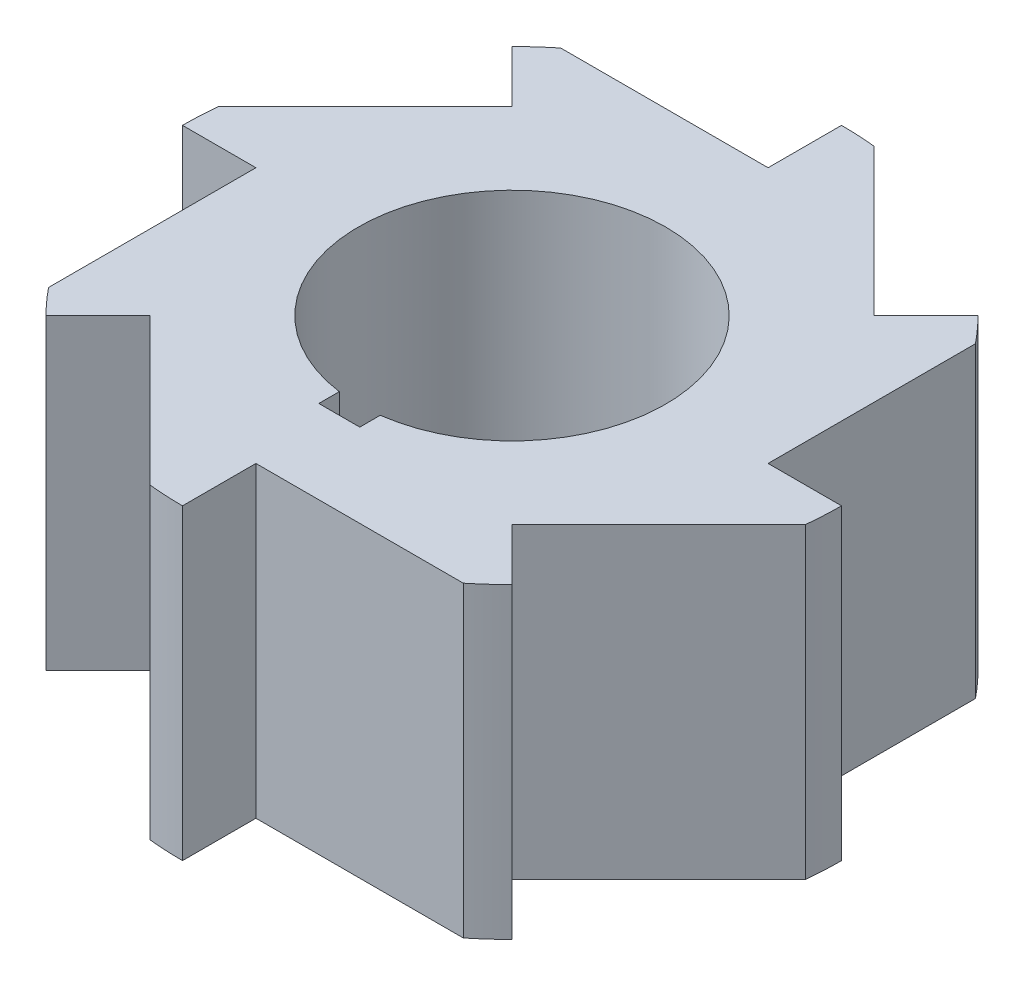
from build123d import *

# Parameters (mm, degrees)
BOSS_EXTRUDE3_DEPTH = 30


with BuildPart() as part:
    # Sketch1 → Boss-Extrude3 (new body)
    with BuildSketch(Plane(origin=(0, 0, 0), x_dir=(1, 0, 0), z_dir=(0, 1, 0))):
        with BuildLine():
            Line((0, -25), (0, -32.168320657))
            ThreePointArc((0, -32.168320657), (-1.683972021, -32.124213487), (-3.36332613, -31.992012929))
            Line((-3.36332613, -31.992012929), (-17.67766953, -17.67766953))
            Line((-17.67766953, -17.67766953), (-22.746437676, -22.746437676))
            ThreePointArc((-22.746437676, -22.746437676), (-23.905997232, -21.524501161), (-25, -20.243538572))
            Line((-25, -20.243538572), (-25, 0))
            Line((-25, 0), (-32.168320657, 0))
            ThreePointArc((-32.168320657, 0), (-32.124213487, 1.683972021), (-31.992012929, 3.36332613))
            Line((-31.992012929, 3.36332613), (-17.67766953, 17.67766953))
            Line((-17.67766953, 17.67766953), (-22.746437676, 22.746437676))
            ThreePointArc((-22.746437676, 22.746437676), (-21.524501161, 23.905997232), (-20.243538572, 25))
            Line((-20.243538572, 25), (0, 25))
            Line((0, 25), (0, 32.168320657))
            ThreePointArc((0, 32.168320657), (1.683972021, 32.124213487), (3.36332613, 31.992012929))
            Line((3.36332613, 31.992012929), (17.67766953, 17.67766953))
            Line((17.67766953, 17.67766953), (22.746437676, 22.746437676))
            ThreePointArc((22.746437676, 22.746437676), (23.905997232, 21.524501161), (25, 20.243538572))
            Line((25, 20.243538572), (25, 0))
            Line((25, 0), (32.168320657, 0))
            ThreePointArc((32.168320657, 0), (32.124213487, -1.683972021), (31.992012929, -3.36332613))
            Line((31.992012929, -3.36332613), (17.67766953, -17.67766953))
            Line((17.67766953, -17.67766953), (22.746437676, -22.746437676))
            ThreePointArc((22.746437676, -22.746437676), (21.524501161, -23.905997232), (20.243538572, -25))
            Line((20.243538572, -25), (0, -25))
        make_face()
        with BuildLine():
            Line((-2, -16.860742714), (-2, -14.860742714))
            ThreePointArc((-2, -14.860742714), (0, 14.994721539), (2, -14.860742714))
            Line((2, -14.860742714), (2, -16.860742714))
            Line((2, -16.860742714), (-2, -16.860742714))
        make_face(mode=Mode.SUBTRACT)
    extrude(amount=BOSS_EXTRUDE3_DEPTH)


solid = part.part
